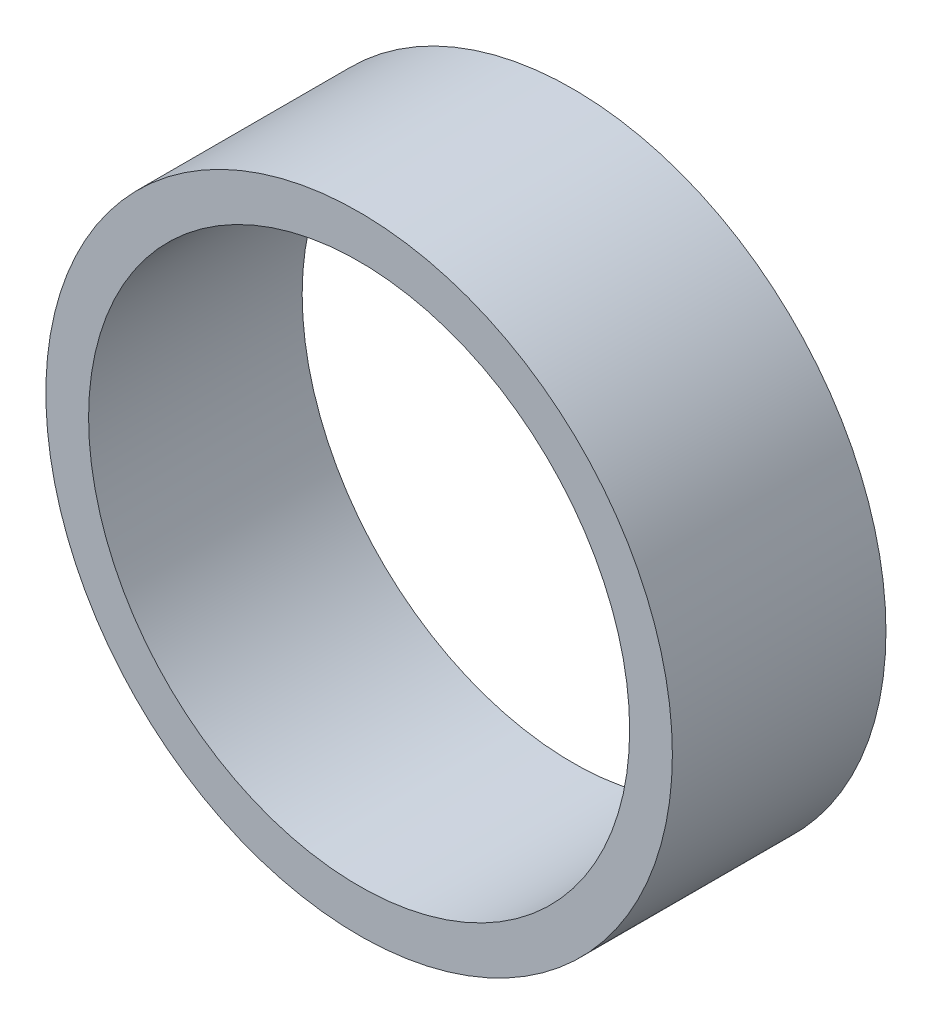
from build123d import *

# Parameters (mm, degrees)
SKETCH_1_R      = 22
SKETCH_1_R_2    = 19
EXTRUDE_1_DEPTH = 15


with BuildPart() as part:
    # 草图1 → 凸台-拉伸1 (new body)
    with BuildSketch(Plane.XY):
        Circle(SKETCH_1_R)
        Circle(SKETCH_1_R_2, mode=Mode.SUBTRACT)
    extrude(amount=EXTRUDE_1_DEPTH)


solid = part.part
